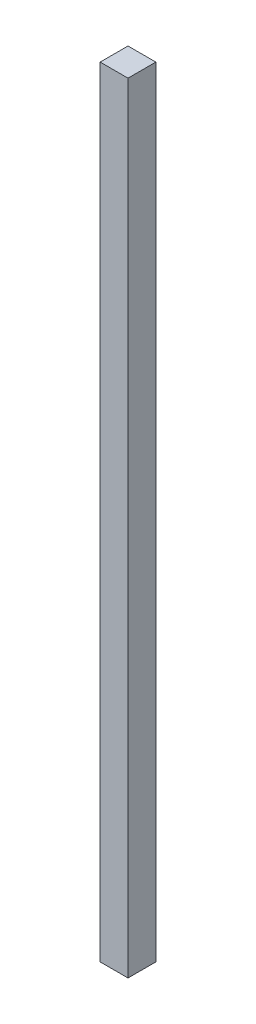
from build123d import *

# Parameters (mm, degrees)
SKETCH_1_W      = 10
SKETCH_1_H      = 10
EXTRUDE_1_DEPTH = 280


with BuildPart() as part:
    # 草图1 → 凸台-拉伸1 (new body)
    with BuildSketch(Plane(origin=(0, 0, 0), x_dir=(1, 0, 0), z_dir=(0, 1, 0))):
        Rectangle(SKETCH_1_W, SKETCH_1_H)
    extrude(amount=EXTRUDE_1_DEPTH)


solid = part.part
